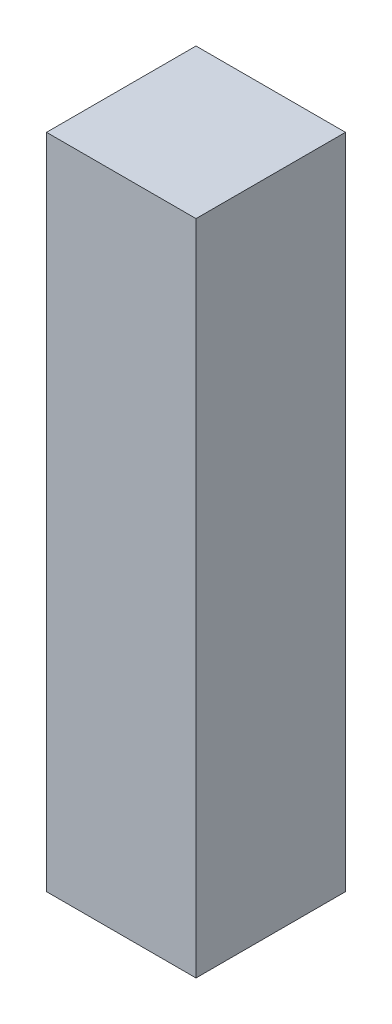
from build123d import *

# Parameters (mm, degrees)
SKIZZE2_W                       = 200
SKIZZE2_H                       = 200
AUFSATZ_LINEAR_AUSTRAGEN1_DEPTH = 880


with BuildPart() as part:
    # Skizze2 → Aufsatz-Linear austragen1 (new body)
    with BuildSketch(Plane(origin=(0, 0, 0), x_dir=(1, 0, 0), z_dir=(0, 1, 0))):
        Rectangle(SKIZZE2_W, SKIZZE2_H)
    extrude(amount=AUFSATZ_LINEAR_AUSTRAGEN1_DEPTH)


solid = part.part
